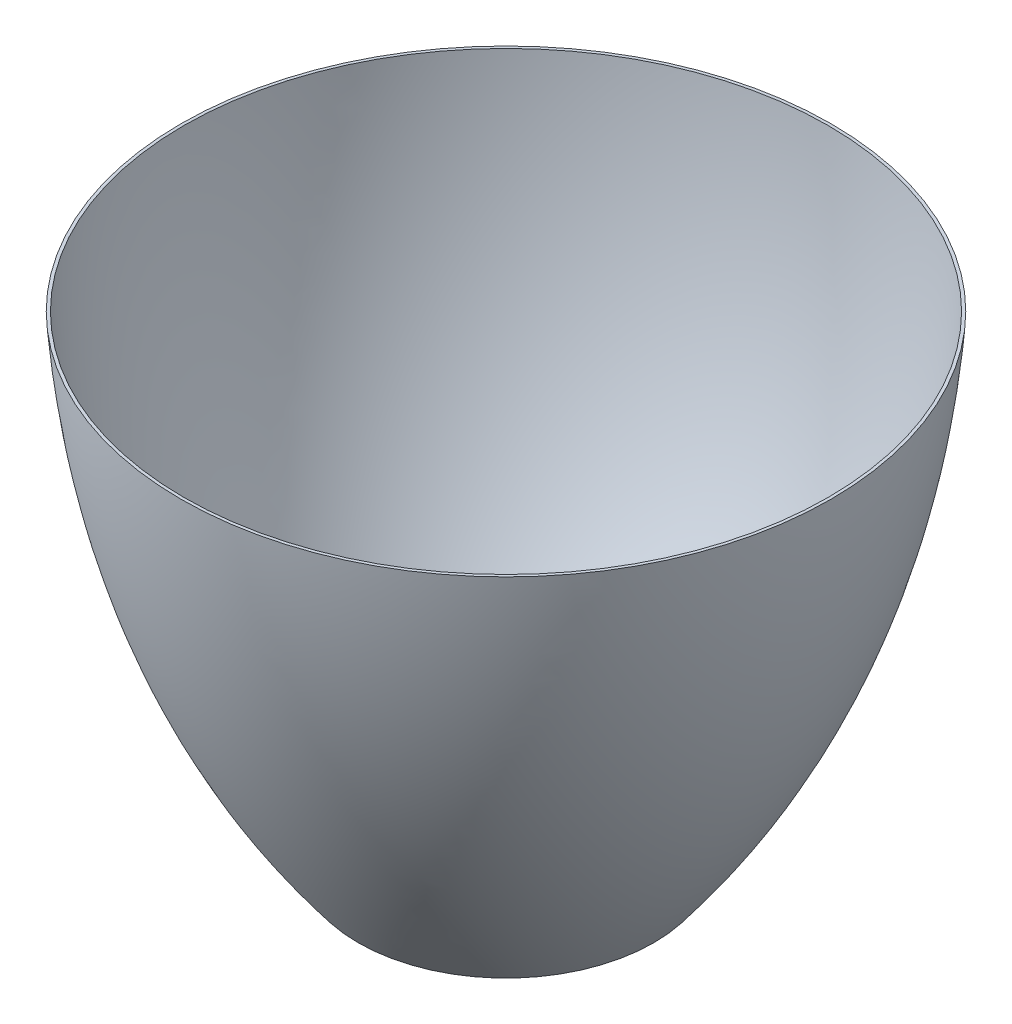
from build123d import *

# Parameters (mm, degrees)
SHELL_1_T = -0.5


with BuildPart() as part:
    # ｽｹｯﾁ1 → 回転1 (revolve)
    with BuildSketch(Plane.XY):
        with BuildLine():
            Line((0, 80), (0, 0))
            Line((0, 0), (25, 0))
            add(Edge.make_bspline(
                [(25, 0), (51.408976261, 34.406528083), (55, 80)],
                knots=[0, 0, 0, 1, 1, 1], degree=2))
            Line((55, 80), (0, 80))
        make_face()
    revolve(axis=Axis((0, 80, 0), (0, -1, 0)))

    # ｼｪﾙ1
    shell_1_openings = [part.faces().sort_by_distance(p)[0] for p in [
        (0, 0, 0),
        (0, 80, 0),
    ]]
    offset(amount=SHELL_1_T, openings=shell_1_openings, kind=Kind.INTERSECTION)


solid = part.part
